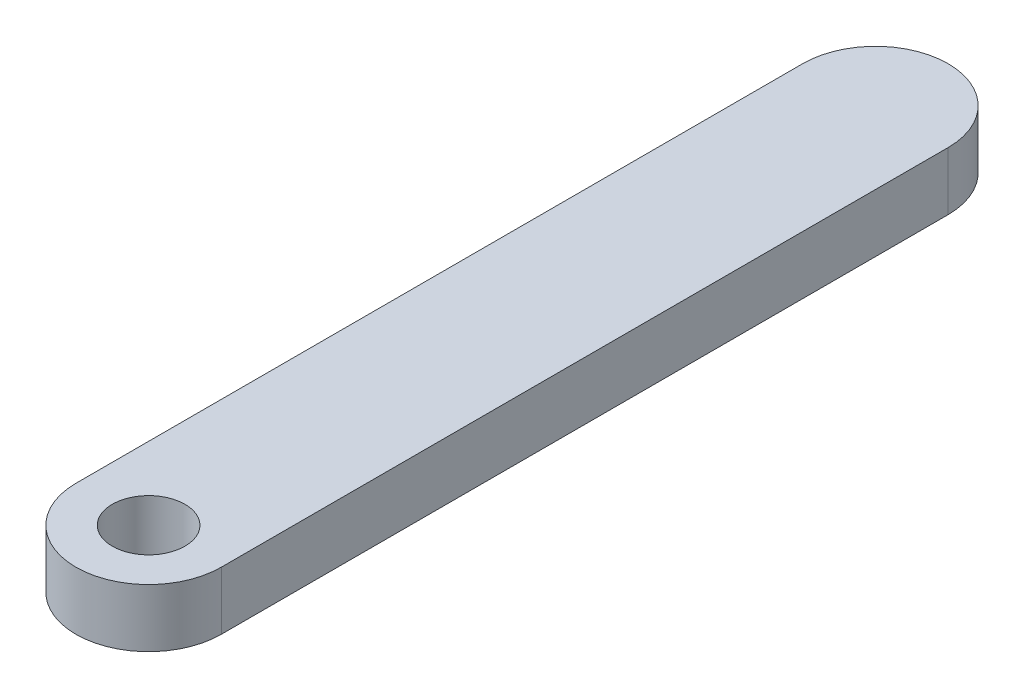
from build123d import *

# Parameters (mm, degrees)
SKETCH_1_R      = 5
EXTRUDE_1_DEPTH = 8


with BuildPart() as part:
    # ｽｹｯﾁ1 → ﾎﾞｽ - 押し出し1 (new body)
    with BuildSketch(Plane(origin=(0, 0, 0), x_dir=(1, 0, 0), z_dir=(0, 1, 0))):
        with BuildLine():
            Line((-10, 0), (-10, 100))
            ThreePointArc((-10, 100), (0, 110), (10, 100))
            Line((10, 100), (10, 0))
            ThreePointArc((10, 0), (0, -10), (-10, 0))
        make_face()
        with Locations(Location((0, 0, 0), (0, 0, 270))):
            Circle(SKETCH_1_R, mode=Mode.SUBTRACT)
    extrude(amount=EXTRUDE_1_DEPTH)


solid = part.part
